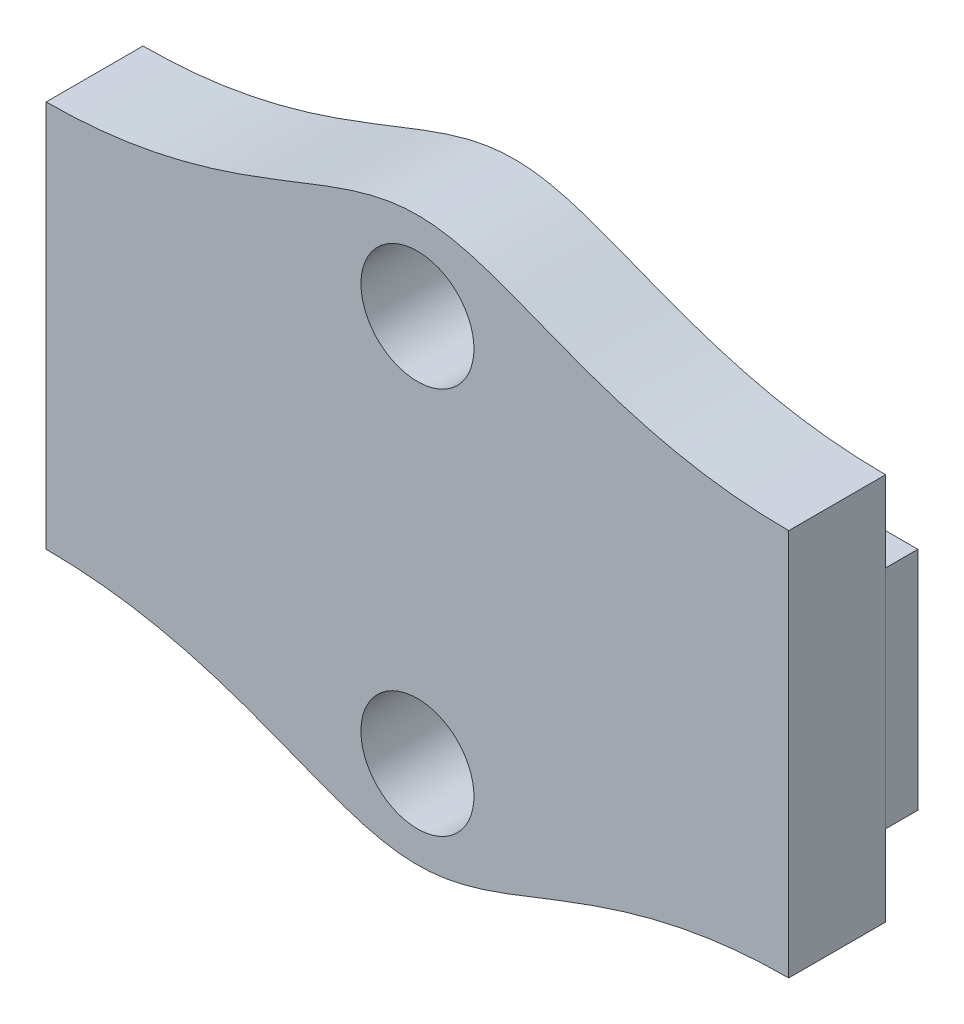
from build123d import *

# Parameters (mm, degrees)
ESQUISSE2_W             = 1
ESQUISSE2_H             = 1
BOSS_EXTRU_1_DEPTH      = 7
BOSS_EXTRU_1_2_DEPTH    = 7
BOSS_EXTRU_1_3_DEPTH    = 7
BOSS_EXTRU_1_4_DEPTH    = 7
BOSS_EXTRU_1_5_DEPTH    = 7
BOSS_EXTRU_1_6_DEPTH    = 7
BOSS_EXTRU_1_7_DEPTH    = 7
BOSS_EXTRU_1_8_DEPTH    = 7
BOSS_EXTRU_1_9_DEPTH    = 7
BOSS_EXTRU_1_10_DEPTH   = 7
BOSS_EXTRU_1_11_DEPTH   = 7
BOSS_EXTRU_1_12_DEPTH   = 7
BOSS_EXTRU_2_DEPTH      = 6
BOSS_EXTRU_2_DEPTH_BACK = 13
ESQUISSE3_W             = 23
ESQUISSE3_H             = 3
ESQUISSE4_R             = 1.75
ENL_V_MAT_EXTRU_1_DEPTH = 3


with BuildPart() as part:
    # Esquisse2 → Boss.-Extru.1 (new body)
    with BuildSketch(Plane(origin=(0, 0, 0), x_dir=(1, 0, 0), z_dir=(0, 1, 0))):
        with Locations((0.5, 3.5)):
            Rectangle(ESQUISSE2_W, ESQUISSE2_H)
    extrude(amount=BOSS_EXTRU_1_DEPTH)


with BuildPart() as body_2:
    # Esquisse2 → Boss.-Extru.1 2 (new body)
    with BuildSketch(Plane(origin=(0, 0, 0), x_dir=(1, 0, 0), z_dir=(0, 1, 0))):
        with Locations((4.5, 3.5)):
            Rectangle(ESQUISSE2_W, ESQUISSE2_H)
    extrude(amount=BOSS_EXTRU_1_2_DEPTH)


with BuildPart() as body_3:
    # Esquisse2 → Boss.-Extru.1 3 (new body)
    with BuildSketch(Plane(origin=(0, 0, 0), x_dir=(1, 0, 0), z_dir=(0, 1, 0))):
        with Locations((6.5, 3.5)):
            Rectangle(ESQUISSE2_W, ESQUISSE2_H)
    extrude(amount=BOSS_EXTRU_1_3_DEPTH)


with BuildPart() as body_4:
    # Esquisse2 → Boss.-Extru.1 4 (new body)
    with BuildSketch(Plane(origin=(0, 0, 0), x_dir=(1, 0, 0), z_dir=(0, 1, 0))):
        with Locations((8.5, 3.5)):
            Rectangle(ESQUISSE2_W, ESQUISSE2_H)
    extrude(amount=BOSS_EXTRU_1_4_DEPTH)


with BuildPart() as body_5:
    # Esquisse2 → Boss.-Extru.1 5 (new body)
    with BuildSketch(Plane(origin=(0, 0, 0), x_dir=(1, 0, 0), z_dir=(0, 1, 0))):
        with Locations((10.5, 3.5)):
            Rectangle(ESQUISSE2_W, ESQUISSE2_H)
    extrude(amount=BOSS_EXTRU_1_5_DEPTH)


with BuildPart() as body_6:
    # Esquisse2 → Boss.-Extru.1 6 (new body)
    with BuildSketch(Plane(origin=(0, 0, 0), x_dir=(1, 0, 0), z_dir=(0, 1, 0))):
        with Locations((12.5, 3.5)):
            Rectangle(ESQUISSE2_W, ESQUISSE2_H)
    extrude(amount=BOSS_EXTRU_1_6_DEPTH)


with BuildPart() as body_7:
    # Esquisse2 → Boss.-Extru.1 7 (new body)
    with BuildSketch(Plane(origin=(0, 0, 0), x_dir=(1, 0, 0), z_dir=(0, 1, 0))):
        with Locations((14.5, 3.5)):
            Rectangle(ESQUISSE2_W, ESQUISSE2_H)
    extrude(amount=BOSS_EXTRU_1_7_DEPTH)


with BuildPart() as body_8:
    # Esquisse2 → Boss.-Extru.1 8 (new body)
    with BuildSketch(Plane(origin=(0, 0, 0), x_dir=(1, 0, 0), z_dir=(0, 1, 0))):
        with Locations((16.5, 3.5)):
            Rectangle(ESQUISSE2_W, ESQUISSE2_H)
    extrude(amount=BOSS_EXTRU_1_8_DEPTH)


with BuildPart() as body_9:
    # Esquisse2 → Boss.-Extru.1 9 (new body)
    with BuildSketch(Plane(origin=(0, 0, 0), x_dir=(1, 0, 0), z_dir=(0, 1, 0))):
        with Locations((18.5, 3.5)):
            Rectangle(ESQUISSE2_W, ESQUISSE2_H)
    extrude(amount=BOSS_EXTRU_1_9_DEPTH)


with BuildPart() as body_10:
    # Esquisse2 → Boss.-Extru.1 10 (new body)
    with BuildSketch(Plane(origin=(0, 0, 0), x_dir=(1, 0, 0), z_dir=(0, 1, 0))):
        with Locations((20.5, 3.5)):
            Rectangle(ESQUISSE2_W, ESQUISSE2_H)
    extrude(amount=BOSS_EXTRU_1_10_DEPTH)


with BuildPart() as body_11:
    # Esquisse2 → Boss.-Extru.1 11 (new body)
    with BuildSketch(Plane(origin=(0, 0, 0), x_dir=(1, 0, 0), z_dir=(0, 1, 0))):
        with Locations((22.5, 3.5)):
            Rectangle(ESQUISSE2_W, ESQUISSE2_H)
    extrude(amount=BOSS_EXTRU_1_11_DEPTH)


with BuildPart() as body_12:
    # Esquisse2 → Boss.-Extru.1 12 (new body)
    with BuildSketch(Plane(origin=(0, 0, 0), x_dir=(1, 0, 0), z_dir=(0, 1, 0))):
        with Locations((2.5, 3.5)):
            Rectangle(ESQUISSE2_W, ESQUISSE2_H)
    extrude(amount=BOSS_EXTRU_1_12_DEPTH)


with BuildPart() as body_13:
    # Esquisse3 → Boss.-Extru.2 (new, two sides: drawn at the far end of the back side and taken through both)
    with BuildSketch(Plane(origin=(0, 7, 0), x_dir=(1, 0, 0), z_dir=(0, 1, 0)).offset(-BOSS_EXTRU_2_DEPTH_BACK)):
        with Locations((11.5, 1.5)):
            Rectangle(ESQUISSE3_W, ESQUISSE3_H)
    extrude(amount=BOSS_EXTRU_2_DEPTH + BOSS_EXTRU_2_DEPTH_BACK)

    # Esquisse4 → Enlèv. mat.-Extru.1 (cut)
    with BuildSketch(Plane(origin=(0, 0, -3), x_dir=(-1, 0, 0), z_dir=(0, 0, -1))):
        with Locations((-11.5, -2.5)):
            Circle(ESQUISSE4_R)
        with Locations((-11.5, 9.5)):
            Circle(ESQUISSE4_R)
        with BuildLine():
            Line((-23, 9.5), (-23, 13))
            Line((-23, 13), (0, 13))
            Line((0, 13), (0, 9.5))
            add(Edge.make_bspline(
                [(-23, 9.5), (-13.25, 9.5), (-11.5, 16.75), (-9.75, 9.5), (0, 9.5)],
                knots=[0, 0, 0, 0, 0, 1, 1, 1, 1, 1], degree=4))
        make_face()
        with BuildLine():
            Line((-23, -6), (0, -6))
            Line((0, -6), (0, -2.5))
            add(Edge.make_bspline(
                [(-23, -2.5), (-13.25, -2.5), (-11.5, -9.75), (-9.75, -2.5), (0, -2.5)],
                knots=[0, 0, 0, 0, 0, 1, 1, 1, 1, 1], degree=4))
            Line((-23, -2.5), (-23, -6))
        make_face()
    extrude(amount=-ENL_V_MAT_EXTRU_1_DEPTH, mode=Mode.SUBTRACT)


solid = Compound([part.part, body_2.part, body_3.part, body_4.part, body_5.part, body_6.part, body_7.part, body_8.part, body_9.part, body_10.part, body_11.part, body_12.part, body_13.part])
